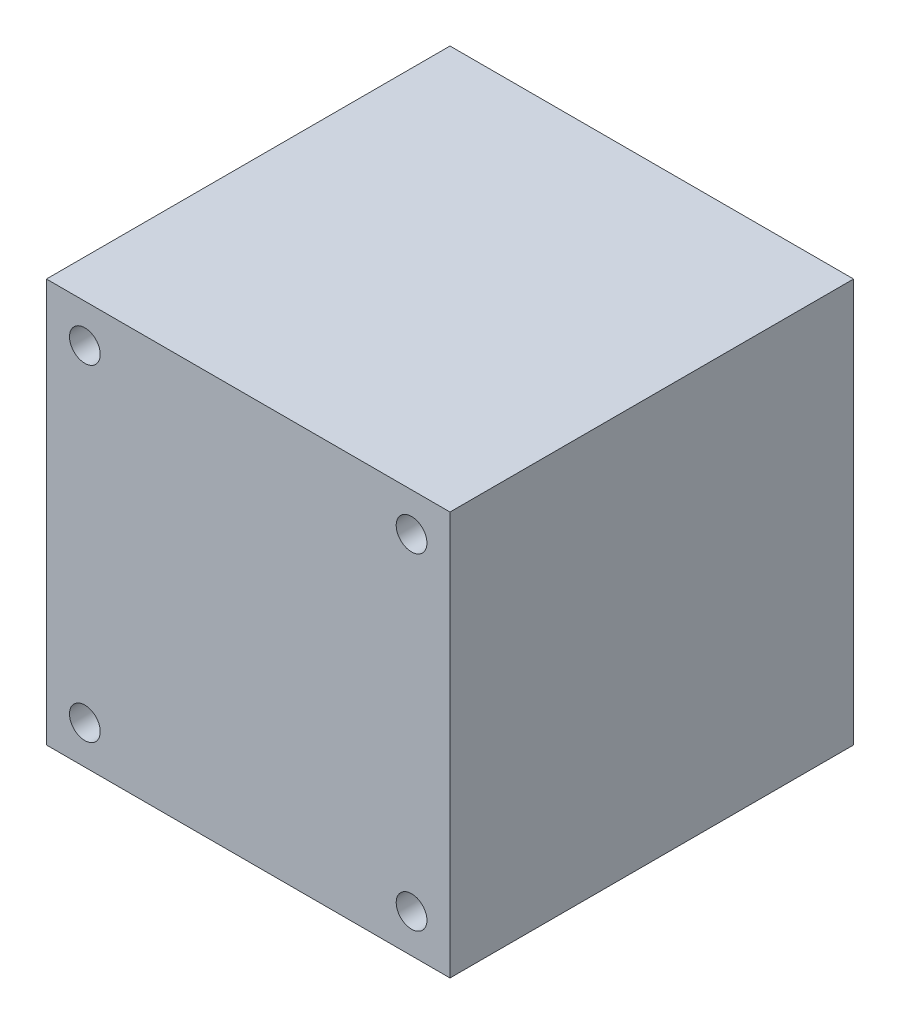
from build123d import *

# Parameters (mm, degrees)
SKETCH1_W           = 42
SKETCH1_H           = 42
SKETCH1_R           = 1.6
BOSS_EXTRUDE1_DEPTH = 42


with BuildPart() as part:
    # Sketch1 → Boss-Extrude1 (new body)
    with BuildSketch(Plane.XY):
        Rectangle(SKETCH1_W, SKETCH1_H)
        with Locations(Location((-17, 17, 0), (0, 0, 180))):
            Circle(SKETCH1_R, mode=Mode.SUBTRACT)
        with Locations(Location((-17, -17, 0), (0, 0, 180))):
            Circle(SKETCH1_R, mode=Mode.SUBTRACT)
        with Locations(Location((17, -17, 0), (0, 0, 180))):
            Circle(SKETCH1_R, mode=Mode.SUBTRACT)
        with Locations(Location((17, 17, 0), (0, 0, 180))):
            Circle(SKETCH1_R, mode=Mode.SUBTRACT)
    extrude(amount=BOSS_EXTRUDE1_DEPTH)


solid = part.part
